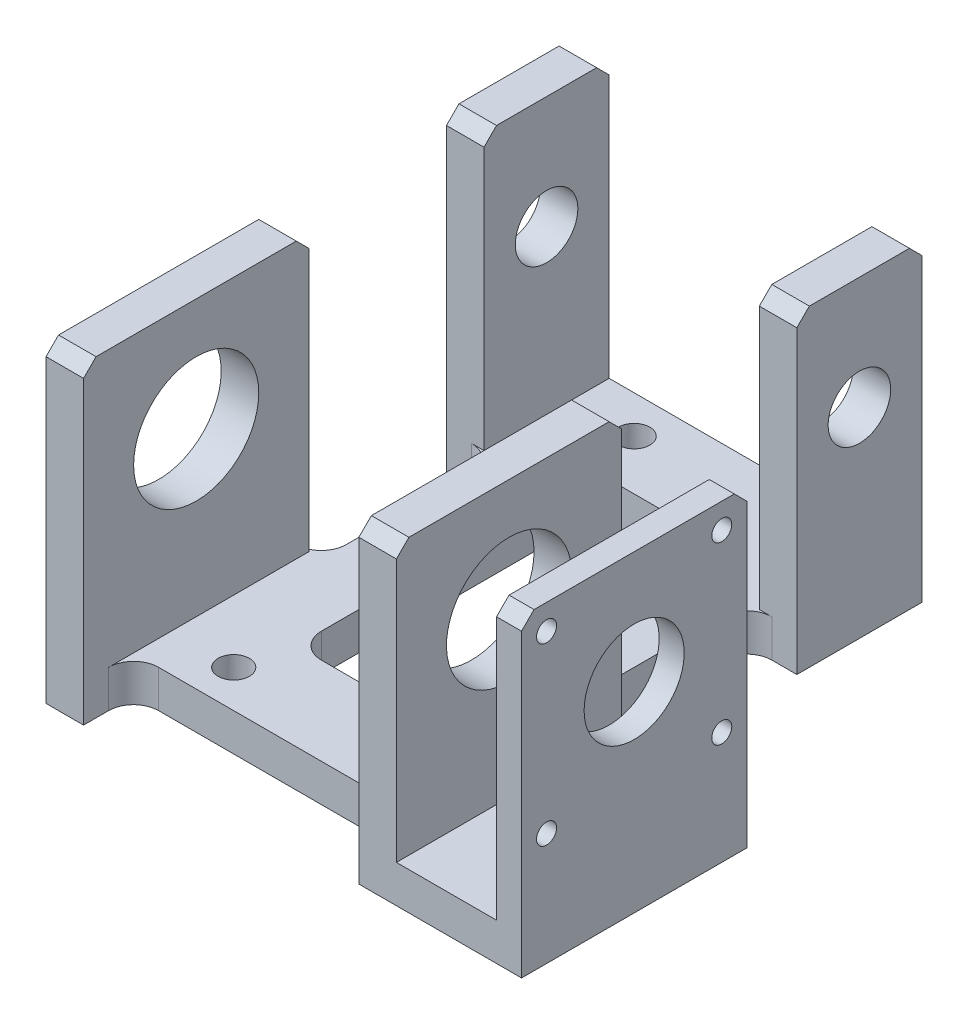
from build123d import *

# Parameters (mm, degrees)
EXTRUDE_1_DEPTH        = 42
SKETCH_2_R             = 2.5
SKETCH_2_R_2           = 5
CUT_EXTRUDE_1_DEPTH    = 57.329388422
EXTRUDE_2_DEPTH        = 18
SKETCH_5_R             = 4
CUT_EXTRUDE_2_DEPTH    = 61.704200843
HOLE_WIZARD_M3_1_D     = 2.5
HOLE_WIZARD_M3_1_DEPTH = 7.5
HOLE_WIZARD_M3_1_TIP   = 0.751075774
SKETCH_9_W             = 22
SKETCH_9_H             = 4
CUT_EXTRUDE_4_DEPTH    = 61.761830124
FILLET_1_R             = 2
SKETCH_10_W            = 10
SKETCH_10_H            = 24
CUT_EXTRUDE_5_DEPTH    = 61.761830124
FILLET_2_R             = 2
SKETCH_11_W            = 4
SKETCH_11_H            = 14
CUT_EXTRUDE_8_DEPTH    = 62.911226769
FILLET_3_R             = 2
SKETCH_12_W            = 28
SKETCH_12_H            = 14
CUT_EXTRUDE_9_DEPTH    = 22
HOLE_WIZARD_M2_1_D     = 1.6
HOLE_WIZARD_M2_1_DEPTH = 4
HOLE_WIZARD_M2_1_TIP   = 0.480688495
CHAMFER_1_SIZE         = 1


with BuildPart() as part:
    # 草图1 → 凸台-拉伸1 (new body)
    with BuildSketch(Plane.XY):
        Polygon((0, 0), (0, 25), (3, 25), (3, 3), (25, 3), (25, 25), (28, 25), (28, 0), align=None)
    extrude(amount=EXTRUDE_1_DEPTH)

    # 草图2 → 切除-拉伸1 (cut, through all)
    with BuildSketch(Plane(origin=(28, 0, 0), x_dir=(0, 0, -1), z_dir=(1, 0, 0))):
        with Locations(Location((-5, 16, 0), (0, 0, 90))):
            Circle(SKETCH_2_R)
        with Locations(Location((-33, 16, 0), (0, 0, 90))):
            Circle(SKETCH_2_R_2)
    extrude(amount=-CUT_EXTRUDE_1_DEPTH, mode=Mode.SUBTRACT)

    # 草图3 → 凸台-拉伸2 (add)
    with BuildSketch(Plane.XY.offset(42)):
        Polygon((28, 0), (38, 0), (38, 25), (36, 25), (36, 3), (28, 3), align=None)
    extrude(amount=-EXTRUDE_2_DEPTH)

    # 草图5 → 切除-拉伸2 (cut, through all)
    with BuildSketch(Plane.ZY.offset(-36)):
        with Locations((33, 16)):
            Circle(SKETCH_5_R)
    extrude(amount=-CUT_EXTRUDE_2_DEPTH, mode=Mode.SUBTRACT)

    # M3 螺纹孔1
    with Locations(Plane(origin=(20, 3, 3), x_dir=(0, 0, 1), z_dir=(0, 1, 0))):
        with Locations((0, 0), (0, -12), (32, 0), (32, -12)):
            Hole(HOLE_WIZARD_M3_1_D / 2, depth=HOLE_WIZARD_M3_1_DEPTH)
            with Locations((0, 0, -(HOLE_WIZARD_M3_1_DEPTH + HOLE_WIZARD_M3_1_TIP / 2))):  # 118° drill point
                Cone(0, HOLE_WIZARD_M3_1_D / 2, HOLE_WIZARD_M3_1_TIP, mode=Mode.SUBTRACT)

    # 草图9 → 切除-拉伸4 (cut, through all)
    with BuildSketch(Plane(origin=(0, 3, 0), x_dir=(1, 0, 0), z_dir=(0, 1, 0))):
        with Locations((14, -40)):
            Rectangle(SKETCH_9_W, SKETCH_9_H)
    extrude(amount=-CUT_EXTRUDE_4_DEPTH, mode=Mode.SUBTRACT)

    # 圆角1
    fillet_1_edges = [part.edges().sort_by_distance(p)[0] for p in [
        (3, 1.5, 38),
        (25, 1.5, 38),
    ]]
    fillet(fillet_1_edges, radius=FILLET_1_R)

    # 草图10 → 切除-拉伸5 (cut, through all)
    with BuildSketch(Plane(origin=(0, 3, 0), x_dir=(1, 0, 0), z_dir=(0, 1, 0))):
        with Locations((14, -19)):
            Rectangle(SKETCH_10_W, SKETCH_10_H)
    extrude(amount=-CUT_EXTRUDE_5_DEPTH, mode=Mode.SUBTRACT)

    # 圆角2
    fillet_2_edges = [part.edges().sort_by_distance(p)[0] for p in [
        (19, 1.5, 7),
        (19, 1.5, 31),
        (9, 1.5, 31),
        (9, 1.5, 7),
    ]]
    fillet(fillet_2_edges, radius=FILLET_2_R)

    # 草图11 → 切除-拉伸8 (cut, through all)
    with BuildSketch(Plane(origin=(0, 25, 0), x_dir=(1, 0, 0), z_dir=(0, 1, 0))):
        with Locations((26, -17)):
            Rectangle(SKETCH_11_W, SKETCH_11_H)
        with Locations((2, -17)):
            Rectangle(SKETCH_11_W, SKETCH_11_H)
    extrude(amount=-CUT_EXTRUDE_8_DEPTH, mode=Mode.SUBTRACT)

    # 圆角3
    fillet_3_edges = [part.edges().sort_by_distance(p)[0] for p in [
        (4, 1.5, 10),
        (4, 1.5, 24),
        (24, 1.5, 24),
        (24, 1.5, 10),
    ]]
    fillet(fillet_3_edges, radius=FILLET_3_R)

    # 草图12 → 切除-拉伸9 (cut)
    with BuildSketch(Plane(origin=(0, 25, 0), x_dir=(1, 0, 0), z_dir=(0, 1, 0))):
        with Locations((14, -17)):
            Rectangle(SKETCH_12_W, SKETCH_12_H)
    extrude(amount=-CUT_EXTRUDE_9_DEPTH, mode=Mode.SUBTRACT)

    # M2 螺纹孔1
    with Locations(Plane(origin=(38, 23, 40), x_dir=(0, 0, 1), z_dir=(1, 0, 0))):
        with Locations((0, 0), (-14, 0), (-14, 14), (0, 14)):
            Hole(HOLE_WIZARD_M2_1_D / 2, depth=HOLE_WIZARD_M2_1_DEPTH)
            with Locations((0, 0, -(HOLE_WIZARD_M2_1_DEPTH + HOLE_WIZARD_M2_1_TIP / 2))):  # 118° drill point
                Cone(0, HOLE_WIZARD_M2_1_D / 2, HOLE_WIZARD_M2_1_TIP, mode=Mode.SUBTRACT)

    # 倒角1
    chamfer_1_edges = [part.edges().sort_by_distance(p)[0] for p in [
        (26.5, 25, 42),
        (26.5, 25, 10),
        (1.5, 25, 24),
        (1.5, 25, 10),
        (26.5, 25, 24),
        (1.5, 25, 42),
        (37, 25, 24),
        (37, 25, 42),
        (1.5, 25, 0),
        (26.5, 25, 0),
    ]]
    chamfer(chamfer_1_edges, length=CHAMFER_1_SIZE)


solid = part.part
